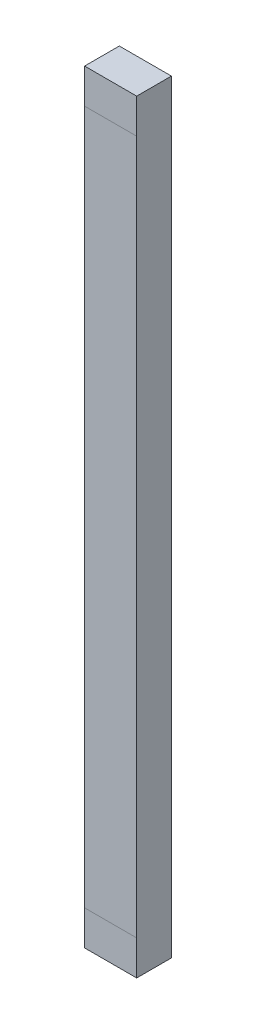
from build123d import *

# Parameters (mm, degrees)
SZKIC1_W                    = 150
SZKIC1_H                    = 100
DODANIE_WYCI_GNI_CIE1_DEPTH = 2200


with BuildPart() as part:
    # Szkic1 → Dodanie-wyciągnięcie1 (new body)
    with BuildSketch(Plane(origin=(0, 0, 0), x_dir=(1, 0, 0), z_dir=(0, 1, 0))):
        with Locations((75, 50)):
            Rectangle(SZKIC1_W, SZKIC1_H)
    extrude(amount=DODANIE_WYCI_GNI_CIE1_DEPTH)


solid = part.part
